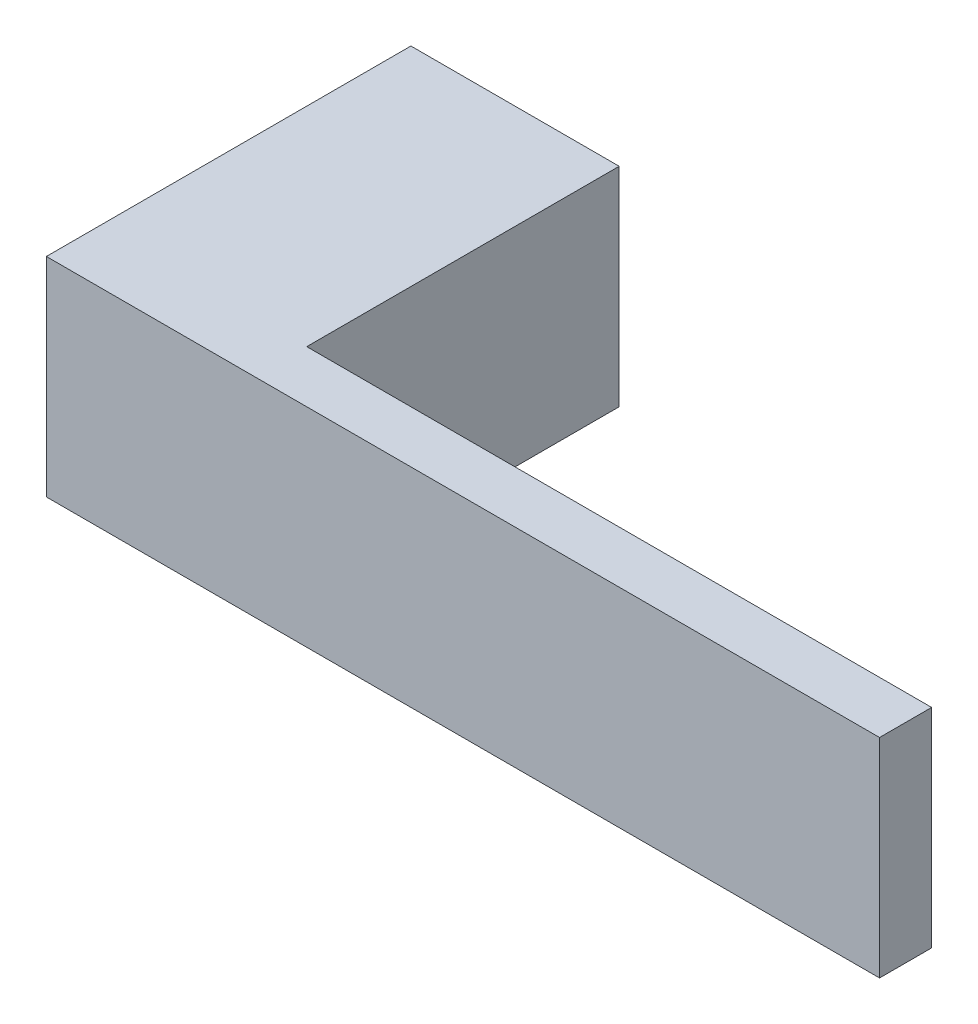
from build123d import *

# Parameters (mm, degrees)
BOSS_EXTRUDE1_DEPTH = 20


with BuildPart() as part:
    # Sketch2 → Boss-Extrude1 (new body)
    with BuildSketch(Plane(origin=(0, 0, 0), x_dir=(1, 0, 0), z_dir=(0, 1, 0))):
        Polygon((0, -35), (0, 0), (20, 0), (20, -30), (80, -30), (80, -35), align=None)
    extrude(amount=BOSS_EXTRUDE1_DEPTH)


solid = part.part
